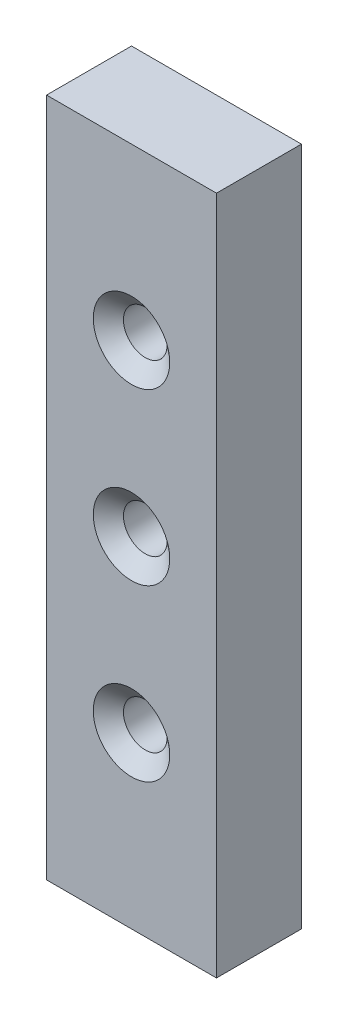
from build123d import *

# Parameters (mm, degrees)
SKETCH1_W                                         = 12.7
SKETCH1_H                                         = 50.8
BOSS_EXTRUDE1_DEPTH                               = 3.175
CSK_FOR_4_FLAT_HEAD_MACHINE_SCREW_100_D           = 3.2639
CSK_FOR_4_FLAT_HEAD_MACHINE_SCREW_100_CSINK_D     = 5.715
CSK_FOR_4_FLAT_HEAD_MACHINE_SCREW_100_CSINK_ANGLE = 100


with BuildPart() as part:
    # Sketch1 → Boss-Extrude1 (new, symmetric)
    with BuildSketch(Plane.XY):
        Rectangle(SKETCH1_W, SKETCH1_H)
    extrude(amount=BOSS_EXTRUDE1_DEPTH, both=True)

    # CSK for #4 Flat Head Machine Screw (100)1 (through all)
    with Locations(Plane.XY.offset(3.175)):
        with Locations((0, 12.7), (0, 0), (0, -12.7)):
            CounterSinkHole(CSK_FOR_4_FLAT_HEAD_MACHINE_SCREW_100_D / 2, CSK_FOR_4_FLAT_HEAD_MACHINE_SCREW_100_CSINK_D / 2, counter_sink_angle=CSK_FOR_4_FLAT_HEAD_MACHINE_SCREW_100_CSINK_ANGLE)


solid = part.part
